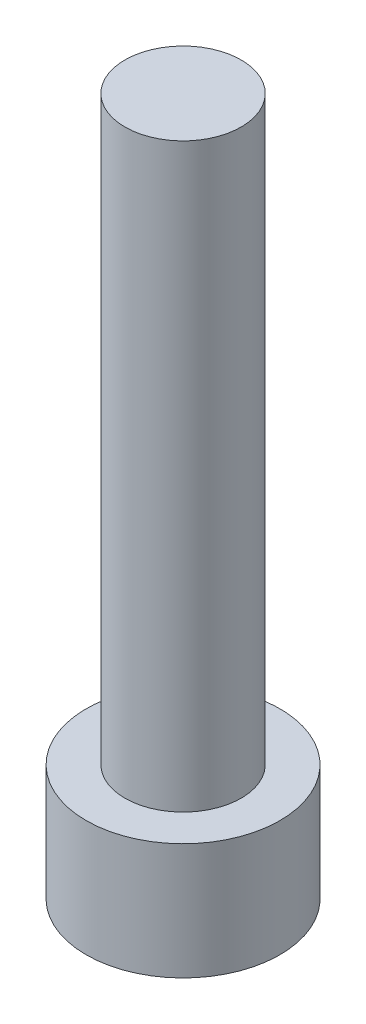
from build123d import *

# Parameters (mm, degrees)
SKETCH_1_R          = 5
EXTRUDE_1_DEPTH     = 6
EXTRUDE_START       = 6
SKETCH_2_R          = 3
EXTRUDE_2_DEPTH     = 30
CUT_EXTRUDE_1_DEPTH = 3


with BuildPart() as part:
    # 草图1 → 凸台-拉伸1 (new body)
    with BuildSketch(Plane(origin=(0, 0, 0), x_dir=(1, 0, 0), z_dir=(0, 1, 0))):
        with Locations(Location((0, 0, 0), (0, 0, 270))):
            Circle(SKETCH_1_R)
    extrude(amount=EXTRUDE_1_DEPTH)

    # 草图2 → 凸台-拉伸2 (add)
    with BuildSketch(Plane(origin=(0, 0, 0), x_dir=(1, 0, 0), z_dir=(0, 1, 0)).offset(EXTRUDE_START)):
        with Locations(Location((0, 0, 0), (0, 0, 270))):
            Circle(SKETCH_2_R)
    extrude(amount=EXTRUDE_2_DEPTH)

    # 草图4 → 切除-拉伸1 (cut)
    with BuildSketch(Plane(origin=(0, 0, 0), x_dir=(1, 0, 0), z_dir=(0, 1, 0))):
        Polygon((2.886751346, 0), (1.443375673, 2.5), (-1.443375673, 2.5), (-2.886751346, 0), (-1.443375673, -2.5), (1.443375673, -2.5), align=None)
    extrude(amount=CUT_EXTRUDE_1_DEPTH, mode=Mode.SUBTRACT)


solid = part.part
